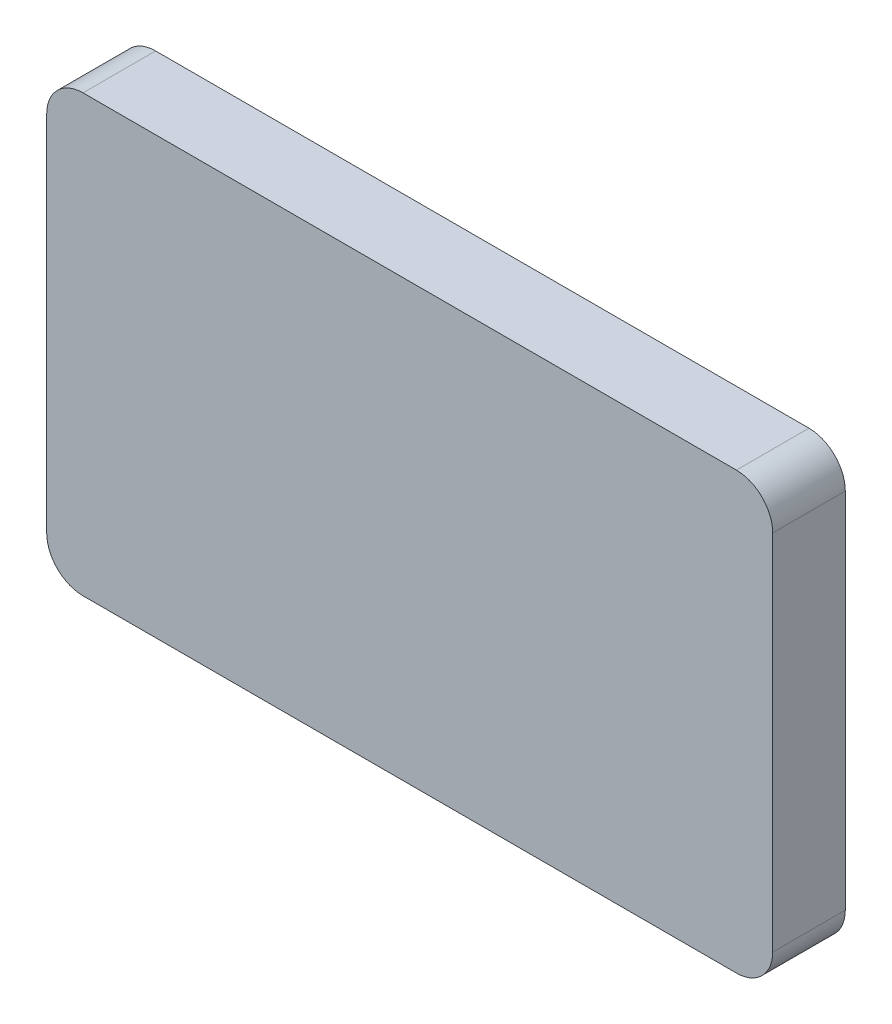
from build123d import *

# Parameters (mm, degrees)
SKETCH1_W           = 127
SKETCH1_H           = 76.2
BOSS_EXTRUDE2_DEPTH = 12.7
FILLET2_R           = 6.35


with BuildPart() as part:
    # Sketch1 → Boss-Extrude2 (new body)
    with BuildSketch(Plane.XY):
        Rectangle(SKETCH1_W, SKETCH1_H)
    extrude(amount=BOSS_EXTRUDE2_DEPTH)

    # Fillet2
    fillet2_edges = [part.edges().sort_by_distance(p)[0] for p in [
        (63.5, -38.1, 6.35),
        (-63.5, -38.1, 6.35),
        (-63.5, 38.1, 6.35),
        (63.5, 38.1, 6.35),
    ]]
    fillet(fillet2_edges, radius=FILLET2_R)


solid = part.part
